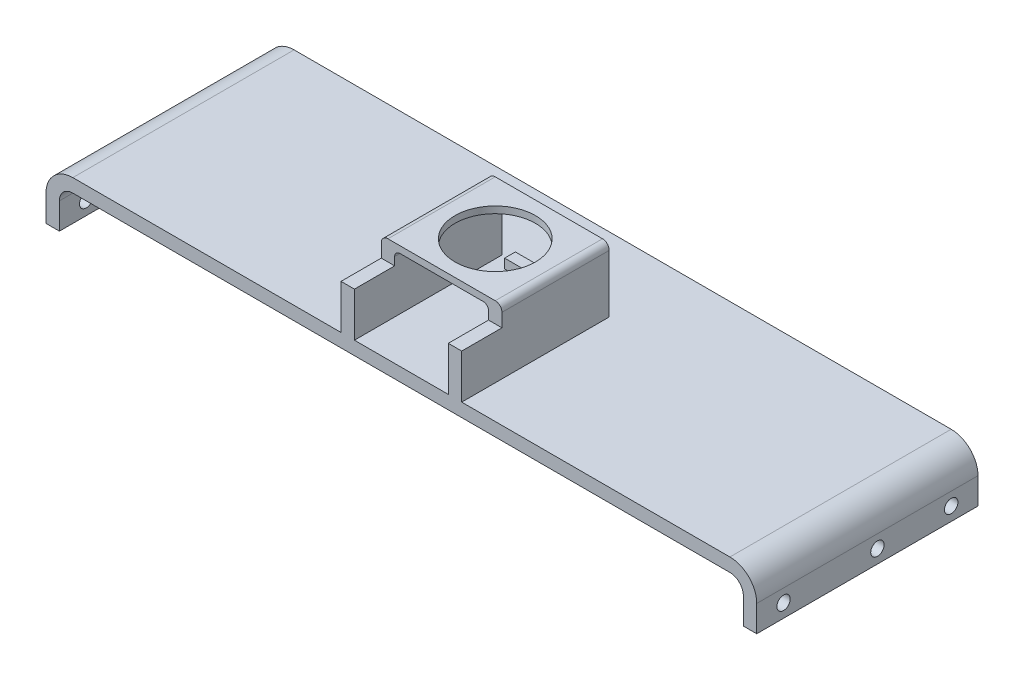
from build123d import *

# Parameters (mm, degrees)
BOSS_EXTRUDE2_DEPTH = 165
SKETCH2_R           = 5
CUT_EXTRUDE1_DEPTH  = 557.500817609
SKETCH3_W           = 10
SKETCH3_H           = 110
BOSS_EXTRUDE3_DEPTH = 33
BOSS_EXTRUDE4_DEPTH = 80
SKETCH5_R           = 30
CUT_EXTRUDE2_DEPTH  = 5
BOSS_EXTRUDE5_DEPTH = 7


with BuildPart() as part:
    # Sketch1 → Boss-Extrude2 (new body)
    with BuildSketch(Plane.XY):
        with BuildLine():
            Line((20, 29.6), (510, 29.6))
            ThreePointArc((510, 29.6), (517.071067812, 26.671067812), (520, 19.6))
            Line((520, 19.6), (520, 0))
            Line((520, 0), (530, 0))
            Line((530, 0), (530, 19.6))
            ThreePointArc((530, 19.6), (524.142135624, 33.742135624), (510, 39.6))
            Line((510, 39.6), (20, 39.6))
            ThreePointArc((20, 39.6), (5.857864376, 33.742135624), (0, 19.6))
            Line((0, 19.6), (0, 0))
            Line((0, 0), (10, 0))
            Line((10, 0), (10, 19.6))
            ThreePointArc((10, 19.6), (12.928932188, 26.671067812), (20, 29.6))
        make_face()
    extrude(amount=BOSS_EXTRUDE2_DEPTH)

    # Sketch2 → Cut-Extrude1 (cut, through all)
    with BuildSketch(Plane.ZY):
        with Locations((20, 10)):
            Circle(SKETCH2_R)
        with Locations(Location((145, 10, 0), (0, 0, 180))):
            Circle(SKETCH2_R)
        with Locations((75, 10)):
            Circle(SKETCH2_R)
    extrude(amount=-CUT_EXTRUDE1_DEPTH, mode=Mode.SUBTRACT)

    # Sketch3 → Boss-Extrude3 (add)
    with BuildSketch(Plane(origin=(0, 39.6, 0), x_dir=(1, 0, 0), z_dir=(0, 1, 0))):
        with Locations((225, -110)):
            Rectangle(SKETCH3_W, SKETCH3_H)
        with Locations((305, -110)):
            Rectangle(SKETCH3_W, SKETCH3_H)
    extrude(amount=BOSS_EXTRUDE3_DEPTH)

    # Sketch4 → Boss-Extrude4 (add)
    with BuildSketch(Plane(origin=(0, 0, 55), x_dir=(-1, 0, 0), z_dir=(0, 0, -1))):
        with BuildLine():
            Line((-300, 72.6), (-300, 78.6))
            ThreePointArc((-300, 78.6), (-298.828427125, 81.428427125), (-296, 82.6))
            Line((-296, 82.6), (-234, 82.6))
            ThreePointArc((-234, 82.6), (-231.171572875, 81.428427125), (-230, 78.6))
            Line((-230, 78.6), (-230, 72.6))
            Line((-230, 72.6), (-220, 72.6))
            Line((-220, 72.6), (-220, 82.6))
            ThreePointArc((-220, 82.6), (-221.464466094, 86.135533906), (-225, 87.6))
            Line((-225, 87.6), (-305, 87.6))
            ThreePointArc((-305, 87.6), (-308.535533906, 86.135533906), (-310, 82.6))
            Line((-310, 82.6), (-310, 72.6))
            Line((-310, 72.6), (-300, 72.6))
        make_face()
    extrude(amount=-BOSS_EXTRUDE4_DEPTH)

    # Sketch5 → Cut-Extrude2 (cut)
    with BuildSketch(Plane(origin=(0, 87.6, 0), x_dir=(1, 0, 0), z_dir=(0, 1, 0))):
        with Locations(Location((265, -95, 0), (0, 0, 270))):
            Circle(SKETCH5_R)
    extrude(amount=-CUT_EXTRUDE2_DEPTH, mode=Mode.SUBTRACT)

    # 3DSketch2 → Boss-Extrude5 (add)
    with BuildSketch(Plane(origin=(290, 39.6, 55), x_dir=(-0.9874406319167054, 0, 0.1579905011066729), z_dir=(0, -1, 0))):
        Polygon((0, 0), (49.372031596, 7.899525055), (50.635955605, 0), (1.263924009, -7.899525055), (0.840997387, -5.256233666), align=None)
    extrude(amount=-BOSS_EXTRUDE5_DEPTH)


solid = part.part
